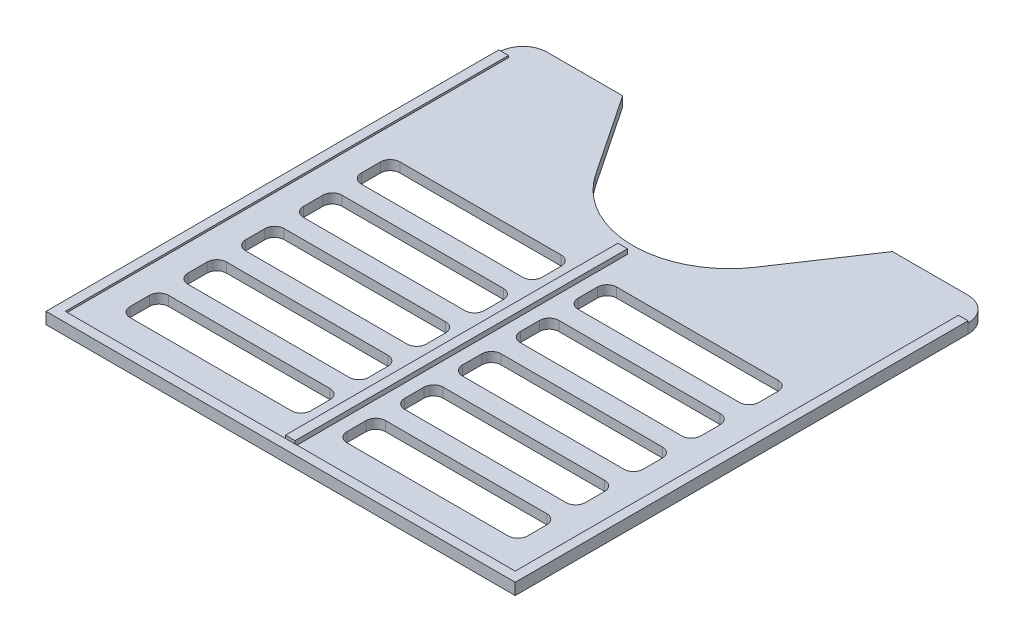
from build123d import *

# Parameters (mm, degrees)
GRUNDK_RPER_DEPTH  = 2
L_FTUNGEN_DEPTH    = 2
SKIZZE4_W          = 2
SKIZZE4_H          = 69
STREBE_DEPTH       = 1
STREBE_AU_EN_DEPTH = 0.4


with BuildPart() as part:
    # Skizze2 → Grundkörper (new body)
    with BuildSketch(Plane(origin=(0, 0, 0), x_dir=(1, 0, 0), z_dir=(0, 1, 0))):
        with BuildLine():
            Line((-43.7, 50), (-28, 50))
            Line((-28, 50), (-16.61985221, 33))
            ThreePointArc((-16.61985221, 33), (0, 24.125669082), (16.61985221, 33))
            Line((16.61985221, 33), (28, 50))
            Line((28, 50), (43.7, 50))
            ThreePointArc((43.7, 50), (47.235533906, 48.535533906), (48.7, 45))
            Line((48.7, 45), (48.7, -49))
            Line((48.7, -49), (-48.7, -49))
            Line((-48.7, -49), (-48.7, 45))
            ThreePointArc((-48.7, 45), (-47.235533906, 48.535533906), (-43.7, 50))
        make_face()
    extrude(amount=GRUNDK_RPER_DEPTH)

    # Skizze3 → Lüftungen (cut)
    with BuildSketch(Plane(origin=(0, 2, 0), x_dir=(1, 0, 0), z_dir=(0, 1, 0))):
        with BuildLine():
            Line((-39.25, 15), (-5.75, 15))
            ThreePointArc((-5.75, 15), (-4.335786438, 14.414213562), (-3.75, 13))
            Line((-3.75, 13), (-3.75, 9))
            ThreePointArc((-3.75, 9), (-4.335786438, 7.585786438), (-5.75, 7))
            Line((-5.75, 7), (-39.25, 7))
            ThreePointArc((-39.25, 7), (-40.664213562, 7.585786438), (-41.25, 9))
            Line((-41.25, 9), (-41.25, 13))
            ThreePointArc((-41.25, 13), (-40.664213562, 14.414213562), (-39.25, 15))
        make_face()
        with BuildLine():
            Line((3.75, 13), (3.75, 9))
            ThreePointArc((3.75, 9), (4.335786438, 7.585786438), (5.75, 7))
            Line((5.75, 7), (39.25, 7))
            ThreePointArc((39.25, 7), (40.664213562, 7.585786438), (41.25, 9))
            Line((41.25, 9), (41.25, 13))
            ThreePointArc((41.25, 13), (40.664213562, 14.414213562), (39.25, 15))
            Line((39.25, 15), (5.75, 15))
            ThreePointArc((5.75, 15), (4.335786438, 14.414213562), (3.75, 13))
        make_face()
        with BuildLine():
            Line((3.75, 1), (3.75, -3))
            ThreePointArc((3.75, -3), (4.335786438, -4.414213562), (5.75, -5))
            Line((5.75, -5), (39.25, -5))
            ThreePointArc((39.25, -5), (40.664213562, -4.414213562), (41.25, -3))
            Line((41.25, -3), (41.25, 1))
            ThreePointArc((41.25, 1), (40.664213562, 2.414213562), (39.25, 3))
            Line((39.25, 3), (5.75, 3))
            ThreePointArc((5.75, 3), (4.335786438, 2.414213562), (3.75, 1))
        make_face()
        with BuildLine():
            Line((3.75, -11), (3.75, -15))
            ThreePointArc((3.75, -15), (4.335786438, -16.414213562), (5.75, -17))
            Line((5.75, -17), (39.25, -17))
            ThreePointArc((39.25, -17), (40.664213562, -16.414213562), (41.25, -15))
            Line((41.25, -15), (41.25, -11))
            ThreePointArc((41.25, -11), (40.664213562, -9.585786438), (39.25, -9))
            Line((39.25, -9), (5.75, -9))
            ThreePointArc((5.75, -9), (4.335786438, -9.585786438), (3.75, -11))
        make_face()
        with BuildLine():
            Line((3.75, -23), (3.75, -27))
            ThreePointArc((3.75, -27), (4.335786438, -28.414213562), (5.75, -29))
            Line((5.75, -29), (39.25, -29))
            ThreePointArc((39.25, -29), (40.664213562, -28.414213562), (41.25, -27))
            Line((41.25, -27), (41.25, -23))
            ThreePointArc((41.25, -23), (40.664213562, -21.585786438), (39.25, -21))
            Line((39.25, -21), (5.75, -21))
            ThreePointArc((5.75, -21), (4.335786438, -21.585786438), (3.75, -23))
        make_face()
        with BuildLine():
            Line((3.75, -35), (3.75, -39))
            ThreePointArc((3.75, -39), (4.335786438, -40.414213562), (5.75, -41))
            Line((5.75, -41), (39.25, -41))
            ThreePointArc((39.25, -41), (40.664213562, -40.414213562), (41.25, -39))
            Line((41.25, -39), (41.25, -35))
            ThreePointArc((41.25, -35), (40.664213562, -33.585786438), (39.25, -33))
            Line((39.25, -33), (5.75, -33))
            ThreePointArc((5.75, -33), (4.335786438, -33.585786438), (3.75, -35))
        make_face()
        with BuildLine():
            Line((-41.25, 1), (-41.25, -3))
            ThreePointArc((-41.25, -3), (-40.664213562, -4.414213562), (-39.25, -5))
            Line((-39.25, -5), (-5.75, -5))
            ThreePointArc((-5.75, -5), (-4.335786438, -4.414213562), (-3.75, -3))
            Line((-3.75, -3), (-3.75, 1))
            ThreePointArc((-3.75, 1), (-4.335786438, 2.414213562), (-5.75, 3))
            Line((-5.75, 3), (-39.25, 3))
            ThreePointArc((-39.25, 3), (-40.664213562, 2.414213562), (-41.25, 1))
        make_face()
        with BuildLine():
            Line((-41.25, -11), (-41.25, -15))
            ThreePointArc((-41.25, -15), (-40.664213562, -16.414213562), (-39.25, -17))
            Line((-39.25, -17), (-5.75, -17))
            ThreePointArc((-5.75, -17), (-4.335786438, -16.414213562), (-3.75, -15))
            Line((-3.75, -15), (-3.75, -11))
            ThreePointArc((-3.75, -11), (-4.335786438, -9.585786438), (-5.75, -9))
            Line((-5.75, -9), (-39.25, -9))
            ThreePointArc((-39.25, -9), (-40.664213562, -9.585786438), (-41.25, -11))
        make_face()
        with BuildLine():
            Line((-41.25, -23), (-41.25, -27))
            ThreePointArc((-41.25, -27), (-40.664213562, -28.414213562), (-39.25, -29))
            Line((-39.25, -29), (-5.75, -29))
            ThreePointArc((-5.75, -29), (-4.335786438, -28.414213562), (-3.75, -27))
            Line((-3.75, -27), (-3.75, -23))
            ThreePointArc((-3.75, -23), (-4.335786438, -21.585786438), (-5.75, -21))
            Line((-5.75, -21), (-39.25, -21))
            ThreePointArc((-39.25, -21), (-40.664213562, -21.585786438), (-41.25, -23))
        make_face()
        with BuildLine():
            Line((-41.25, -35), (-41.25, -39))
            ThreePointArc((-41.25, -39), (-40.664213562, -40.414213562), (-39.25, -41))
            Line((-39.25, -41), (-5.75, -41))
            ThreePointArc((-5.75, -41), (-4.335786438, -40.414213562), (-3.75, -39))
            Line((-3.75, -39), (-3.75, -35))
            ThreePointArc((-3.75, -35), (-4.335786438, -33.585786438), (-5.75, -33))
            Line((-5.75, -33), (-39.25, -33))
            ThreePointArc((-39.25, -33), (-40.664213562, -33.585786438), (-41.25, -35))
        make_face()
    extrude(amount=-L_FTUNGEN_DEPTH, mode=Mode.SUBTRACT)

    # Skizze4 → Strebe (add)
    with BuildSketch(Plane(origin=(0, 2, 0), x_dir=(1, 0, 0), z_dir=(0, 1, 0))):
        with Locations((0, -12.5)):
            Rectangle(SKIZZE4_W, SKIZZE4_H)
    extrude(amount=STREBE_DEPTH)

    # Skizze5 → Strebe außen (add)
    with BuildSketch(Plane(origin=(0, 2, 0), x_dir=(1, 0, 0), z_dir=(0, 1, 0))):
        Polygon((-48.7, 45), (-46.7, 45), (-46.7, -47), (46.7, -47), (46.7, 45), (48.7, 45), (48.7, -49), (-48.7, -49), align=None)
    extrude(amount=STREBE_AU_EN_DEPTH)


solid = part.part
